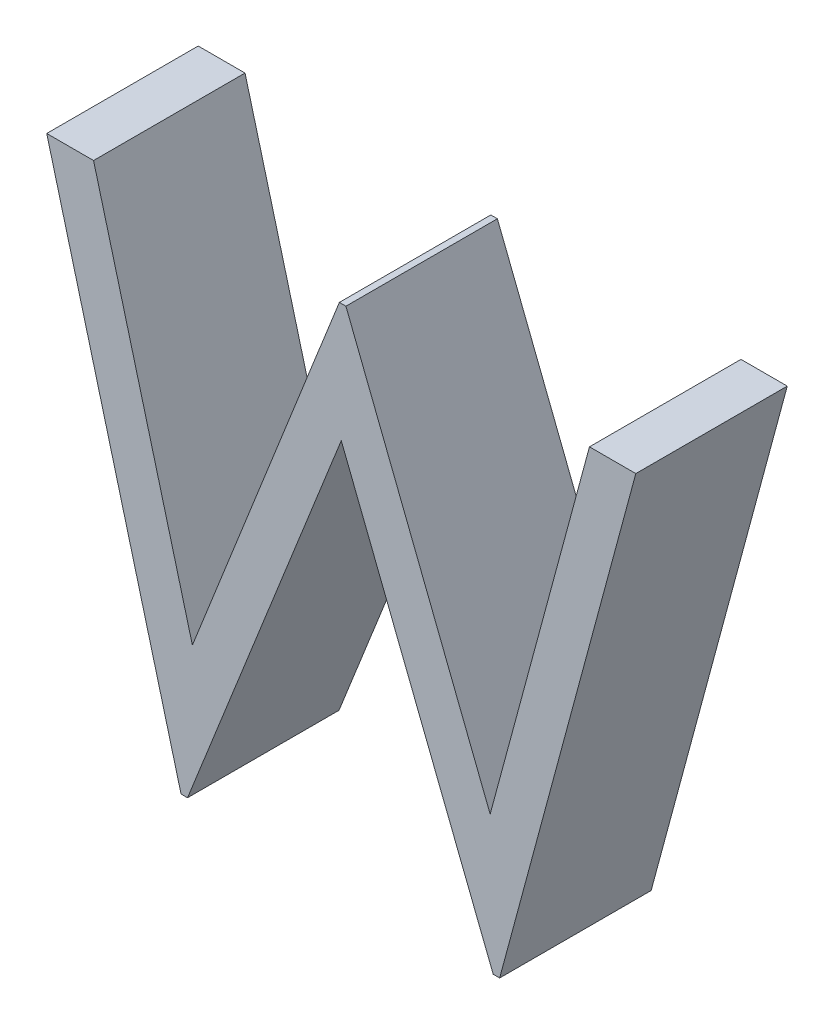
from build123d import *

# Parameters (mm, degrees)
BOSS_EXTRU_1_DEPTH = 1.5


with BuildPart() as part:
    # Esquisse1 → Boss.-Extru.1 (new body)
    with BuildSketch(Plane.XY):
        Polygon((-55.752978146, -17.870119076), (-55.289236159, -17.870119076), (-54.310670454, -21.536986063), (-52.855341928, -17.870119076), (-52.790237762, -17.870119076), (-51.361952505, -21.511945999), (-50.378378787, -17.870119076), (-49.919644813, -17.870119076), (-51.267801864, -22.870119076), (-51.331904428, -22.870119076), (-52.83631148, -19.046000486), (-54.358747377, -22.870119076), (-54.422849941, -22.870119076), align=None)
    extrude(amount=BOSS_EXTRU_1_DEPTH)


solid = part.part
